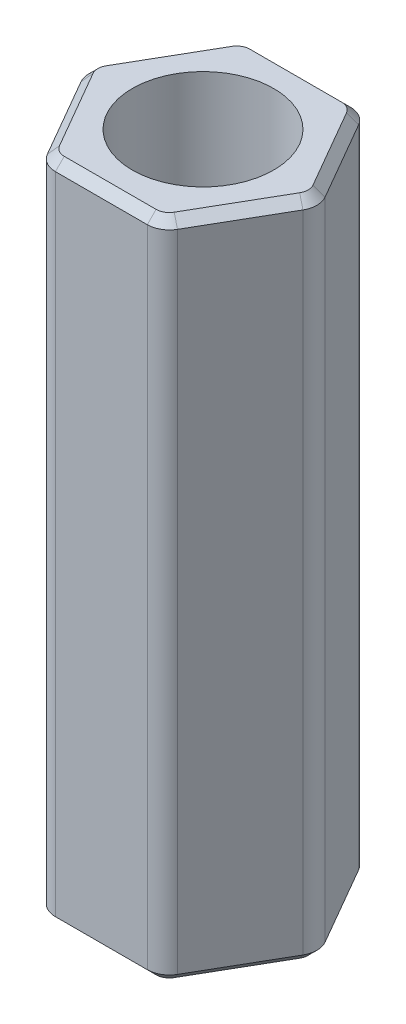
from build123d import *

# Parameters (mm, degrees)
BOSS_EXTRUDE1_DEPTH = 15
SKETCH2_R           = 1.6
CUT_EXTRUDE1_DEPTH  = 16.405951231
FILLET1_R           = 0.5
CHAMFER1_SIZE       = 0.2


with BuildPart() as part:
    # Sketch1 → Boss-Extrude1 (new body)
    with BuildSketch(Plane(origin=(0, 0, 0), x_dir=(1, 0, 0), z_dir=(0, 1, 0))):
        Polygon((1.327905619, -2.3), (2.655811238, 0), (1.327905619, 2.3), (-1.327905619, 2.3), (-2.655811238, 0), (-1.327905619, -2.3), align=None)
    extrude(amount=BOSS_EXTRUDE1_DEPTH)

    # Sketch2 → Cut-Extrude1 (cut, through all)
    with BuildSketch(Plane(origin=(0, 15, 0), x_dir=(1, 0, 0), z_dir=(0, 1, 0))):
        with Locations(Location((0, 0, 0), (0, 0, 270))):
            Circle(SKETCH2_R)
    extrude(amount=-CUT_EXTRUDE1_DEPTH, mode=Mode.SUBTRACT)

    # Fillet1
    fillet1_edges = [part.edges().sort_by_distance(p)[0] for p in [
        (-1.327905619, 7.5, 2.3),
        (-2.655811238, 7.5, 0),
        (-1.327905619, 7.5, -2.3),
        (1.327905619, 7.5, -2.3),
        (2.655811238, 7.5, 0),
        (1.327905619, 7.5, 2.3),
    ]]
    fillet(fillet1_edges, radius=FILLET1_R)

    # Chamfer1
    chamfer1_edges = [part.edges().sort_by_distance(p)[0] for p in [
        (0, 0, 2.3),
        (0, 15, 2.3),
        (-1.991858429, 0, 1.15),
        (-1.991858429, 0, -1.15),
        (0, 0, -2.3),
        (1.991858429, 0, -1.15),
        (1.991858429, 0, 1.15),
        (1.289230485, 0, 2.233012702),
        (2.578460969, 0, 0),
        (1.289230485, 0, -2.233012702),
        (-1.289230485, 0, -2.233012702),
        (-2.578460969, 0, 0),
        (-1.289230485, 0, 2.233012702),
        (-1.991858429, 15, 1.15),
        (1.991858429, 15, 1.15),
        (1.991858429, 15, -1.15),
        (0, 15, -2.3),
        (-1.991858429, 15, -1.15),
        (1.289230485, 15, 2.233012702),
        (2.578460969, 15, 0),
        (1.289230485, 15, -2.233012702),
        (-1.289230485, 15, -2.233012702),
        (-2.578460969, 15, 0),
        (-1.289230485, 15, 2.233012702),
    ]]
    chamfer(chamfer1_edges, length=CHAMFER1_SIZE)


solid = part.part
